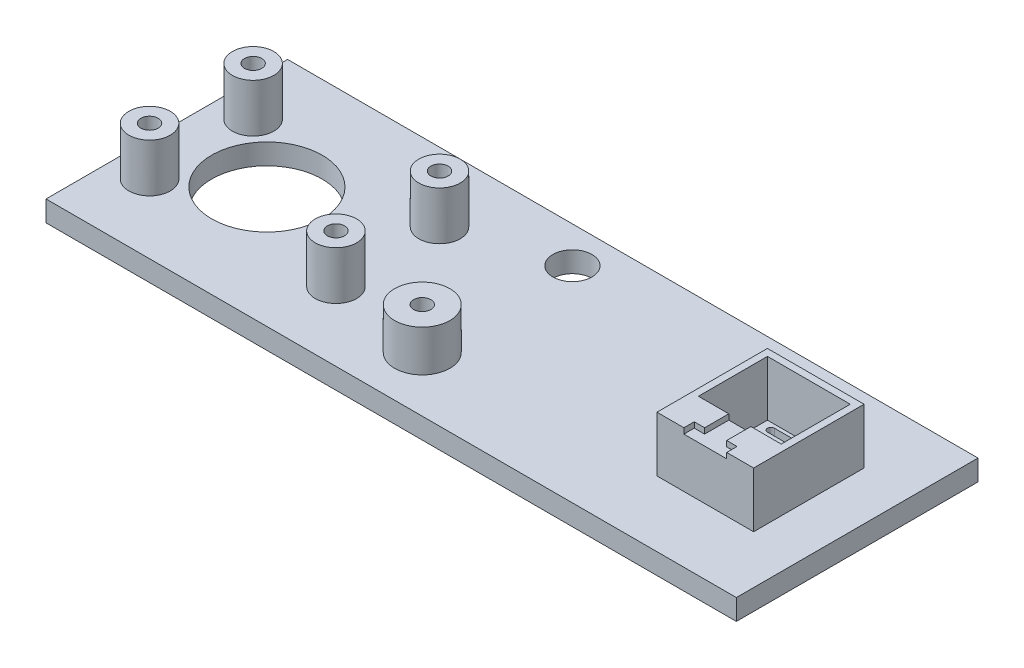
from build123d import *

# Parameters (mm, degrees)
SKETCH1_W           = 100
SKETCH1_H           = 35
BOSS_EXTRUDE1_DEPTH = 3
SKETCH2_R           = 3
BOSS_EXTRUDE2_DEPTH = 7
CUT_EXTRUDE2_REACH  = 108.179
SKETCH3_R           = 8
SKETCH4_R           = 1.25
CUT_EXTRUDE3_DEPTH  = 6
SKETCH5_R           = 4
SKETCH5_R_2         = 1.25
BOSS_EXTRUDE3_DEPTH = 6
CUT_EXTRUDE4_REACH  = 108.419
SKETCH6_R           = 2.83
SKETCH8_W           = 14
SKETCH8_H           = 16
SKETCH8_W_2         = 12
SKETCH8_H_2         = 10
BOSS_EXTRUDE4_DEPTH = 8
CUT_EXTRUDE5_DEPTH  = 0.8
CUT_EXTRUDE6_REACH  = 108.25


with BuildPart() as part:
    # Sketch1 → Boss-Extrude1 (new body)
    with BuildSketch(Plane(origin=(0, 0, 0), x_dir=(1, 0, 0), z_dir=(0, 1, 0))):
        with Locations((50, 17.5)):
            Rectangle(SKETCH1_W, SKETCH1_H)
    extrude(amount=BOSS_EXTRUDE1_DEPTH)

    # Sketch2 → Boss-Extrude2 (add)
    with BuildSketch(Plane(origin=(0, 3, 0), x_dir=(1, 0, 0), z_dir=(0, 1, 0))):
        with Locations(Location((5, 25, 0), (0, 0, 90))):
            Circle(SKETCH2_R)
        with Locations(Location((5, 10, 0), (0, 0, 90))):
            Circle(SKETCH2_R)
        with Locations(Location((32, 10, 0), (0, 0, 90))):
            Circle(SKETCH2_R)
        with Locations(Location((32, 25, 0), (0, 0, 90))):
            Circle(SKETCH2_R)
    extrude(amount=BOSS_EXTRUDE2_DEPTH)

    # Sketch3 → Cut-Extrude2 (cut, up to next)
    with BuildSketch(Plane(origin=(0, 3, 0), x_dir=(1, 0, 0), z_dir=(0, 1, 0)), mode=Mode.PRIVATE) as cut_extrude2_sk1:
        with Locations(Location((14.5, 17.5, 0), (0, 0, 270))):
            Circle(SKETCH3_R)
    cut_extrude2_tool1 = extrude(cut_extrude2_sk1.sketch, amount=-CUT_EXTRUDE2_REACH, mode=Mode.PRIVATE) & part.part
    add(cut_extrude2_tool1.solids().sort_by_distance((14.5, 3, -17.5))[0], mode=Mode.SUBTRACT)

    # Sketch4 → Cut-Extrude3 (cut)
    with BuildSketch(Plane(origin=(0, 10, 0), x_dir=(1, 0, 0), z_dir=(0, 1, 0))):
        with Locations(Location((32, 25, 0), (0, 0, 270))):
            Circle(SKETCH4_R)
        with Locations(Location((32, 10, 0), (0, 0, 270))):
            Circle(SKETCH4_R)
        with Locations(Location((5, 10, 0), (0, 0, 270))):
            Circle(SKETCH4_R)
        with Locations(Location((5, 25, 0), (0, 0, 270))):
            Circle(SKETCH4_R)
    extrude(amount=-CUT_EXTRUDE3_DEPTH, mode=Mode.SUBTRACT)

    # Sketch5 → Boss-Extrude3 (add)
    with BuildSketch(Plane(origin=(0, 3, 0), x_dir=(1, 0, 0), z_dir=(0, 1, 0))):
        with Locations(Location((46.5, 8, 0), (0, 0, 90))):
            Circle(SKETCH5_R)
        with Locations(Location((46.5, 8, 0), (0, 0, 270))):
            Circle(SKETCH5_R_2, mode=Mode.SUBTRACT)
    extrude(amount=BOSS_EXTRUDE3_DEPTH)

    # Sketch6 → Cut-Extrude4 (cut, up to next)
    with BuildSketch(Plane.XZ, mode=Mode.PRIVATE) as cut_extrude4_sk1:
        with Locations(Location((46.5, -29.75, 0), (0, 0, 270))):
            Circle(SKETCH6_R)
    cut_extrude4_tool1 = extrude(cut_extrude4_sk1.sketch, amount=-CUT_EXTRUDE4_REACH, mode=Mode.PRIVATE) & part.part
    add(cut_extrude4_tool1.solids().sort_by_distance((46.5, 0, -29.75))[0], mode=Mode.SUBTRACT)

    # Sketch8 → Boss-Extrude4 (add)
    with BuildSketch(Plane(origin=(0, 3, 0), x_dir=(1, 0, 0), z_dir=(0, 1, 0))):
        with Locations((86, 17.5)):
            Rectangle(SKETCH8_W, SKETCH8_H)
        with Locations((86, 19.5)):
            Rectangle(SKETCH8_W_2, SKETCH8_H_2, mode=Mode.SUBTRACT)
    extrude(amount=BOSS_EXTRUDE4_DEPTH)

    # Sketch9 → Cut-Extrude5 (cut)
    with BuildSketch(Plane(origin=(0, 11, 0), x_dir=(1, 0, 0), z_dir=(0, 1, 0))):
        Polygon((84.4, 14.5), (84.4, 11), (82.9, 11), (82.9, 9.5), (89.1, 9.5), (89.1, 11), (87.6, 11), (87.6, 14.5), align=None)
    extrude(amount=-CUT_EXTRUDE5_DEPTH, mode=Mode.SUBTRACT)

    # Sketch10 → Cut-Extrude6 (cut, up to next)
    with BuildSketch(Plane(origin=(0, 3, 0), x_dir=(1, 0, 0), z_dir=(0, 1, 0)), mode=Mode.PRIVATE) as cut_extrude6_sk1:
        with BuildLine():
            Line((81.5, 24), (90.5, 24))
            ThreePointArc((90.5, 24), (91, 23.5), (90.5, 23))
            Line((90.5, 23), (81.5, 23))
            ThreePointArc((81.5, 23), (81, 23.5), (81.5, 24))
        make_face()
    cut_extrude6_tool1 = extrude(cut_extrude6_sk1.sketch, amount=-CUT_EXTRUDE6_REACH, mode=Mode.PRIVATE) & part.part
    # Sketch10 → Cut-Extrude6 (cut, up to next)
    with BuildSketch(Plane(origin=(0, 3, 0), x_dir=(1, 0, 0), z_dir=(0, 1, 0)), mode=Mode.PRIVATE) as cut_extrude6_sk2:
        with BuildLine():
            Line((81.5, 22), (90.5, 22))
            ThreePointArc((90.5, 22), (91, 21.5), (90.5, 21))
            Line((90.5, 21), (81.5, 21))
            ThreePointArc((81.5, 21), (81, 21.5), (81.5, 22))
        make_face()
    cut_extrude6_tool2 = extrude(cut_extrude6_sk2.sketch, amount=-CUT_EXTRUDE6_REACH, mode=Mode.PRIVATE) & part.part
    # Sketch10 → Cut-Extrude6 (cut, up to next)
    with BuildSketch(Plane(origin=(0, 3, 0), x_dir=(1, 0, 0), z_dir=(0, 1, 0)), mode=Mode.PRIVATE) as cut_extrude6_sk3:
        with BuildLine():
            Line((81.5, 20), (90.5, 20))
            ThreePointArc((90.5, 20), (91, 19.5), (90.5, 19))
            Line((90.5, 19), (81.5, 19))
            ThreePointArc((81.5, 19), (81, 19.5), (81.5, 20))
        make_face()
    cut_extrude6_tool3 = extrude(cut_extrude6_sk3.sketch, amount=-CUT_EXTRUDE6_REACH, mode=Mode.PRIVATE) & part.part
    # Sketch10 → Cut-Extrude6 (cut, up to next)
    with BuildSketch(Plane(origin=(0, 3, 0), x_dir=(1, 0, 0), z_dir=(0, 1, 0)), mode=Mode.PRIVATE) as cut_extrude6_sk4:
        with BuildLine():
            Line((81.5, 18), (90.5, 18))
            ThreePointArc((90.5, 18), (91, 17.5), (90.5, 17))
            Line((90.5, 17), (81.5, 17))
            ThreePointArc((81.5, 17), (81, 17.5), (81.5, 18))
        make_face()
    cut_extrude6_tool4 = extrude(cut_extrude6_sk4.sketch, amount=-CUT_EXTRUDE6_REACH, mode=Mode.PRIVATE) & part.part
    # Sketch10 → Cut-Extrude6 (cut, up to next)
    with BuildSketch(Plane(origin=(0, 3, 0), x_dir=(1, 0, 0), z_dir=(0, 1, 0)), mode=Mode.PRIVATE) as cut_extrude6_sk5:
        with BuildLine():
            Line((81.5, 16), (90.5, 16))
            ThreePointArc((90.5, 16), (91, 15.5), (90.5, 15))
            Line((90.5, 15), (81.5, 15))
            ThreePointArc((81.5, 15), (81, 15.5), (81.5, 16))
        make_face()
    cut_extrude6_tool5 = extrude(cut_extrude6_sk5.sketch, amount=-CUT_EXTRUDE6_REACH, mode=Mode.PRIVATE) & part.part
    add(cut_extrude6_tool1.solids().sort_by_distance((86, 3, -23.5))[0], mode=Mode.SUBTRACT)
    add(cut_extrude6_tool2.solids().sort_by_distance((86, 3, -21.5))[0], mode=Mode.SUBTRACT)
    add(cut_extrude6_tool3.solids().sort_by_distance((86, 3, -19.5))[0], mode=Mode.SUBTRACT)
    add(cut_extrude6_tool4.solids().sort_by_distance((86, 3, -17.5))[0], mode=Mode.SUBTRACT)
    add(cut_extrude6_tool5.solids().sort_by_distance((86, 3, -15.5))[0], mode=Mode.SUBTRACT)


solid = part.part
